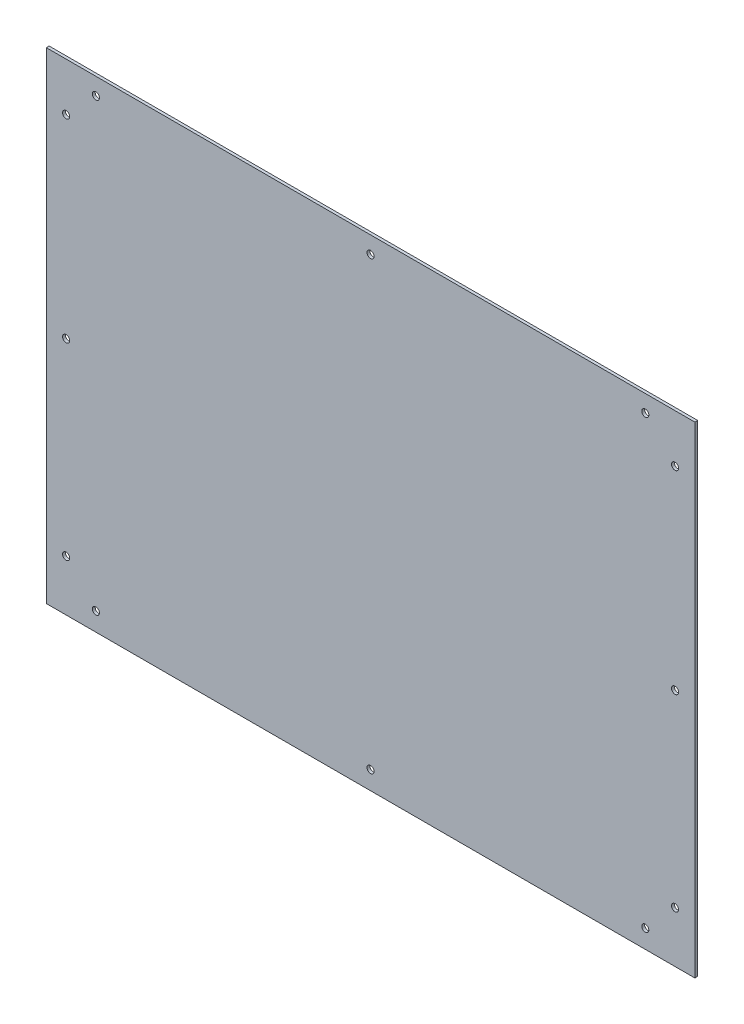
from build123d import *

# Parameters (mm, degrees)
SKETCH1_W           = 458
SKETCH1_H           = 338
BOSS_EXTRUDE1_DEPTH = 2
SKETCH2_R           = 2.5
CUT_EXTRUDE1_DEPTH  = 285.615530145
SKETCH3_W           = 458
SKETCH3_H           = 2
BOSS_EXTRUDE2_DEPTH = 2


with BuildPart() as part:
    # Sketch1 → Boss-Extrude1 (new body)
    with BuildSketch(Plane.XY):
        Rectangle(SKETCH1_W, SKETCH1_H)
    extrude(amount=BOSS_EXTRUDE1_DEPTH)

    # Sketch2 → Cut-Extrude1 (cut, through all)
    with BuildSketch(Plane.XY.offset(2)):
        with Locations((-194, 159)):
            Circle(SKETCH2_R)
        with Locations((-194.002577337, -156)):
            Circle(SKETCH2_R)
        with Locations((193.997422663, -156)):
            Circle(SKETCH2_R)
        with Locations((194, 159)):
            Circle(SKETCH2_R)
        with Locations((-215, 0)):
            Circle(SKETCH2_R)
        with Locations((-215, -133)):
            Circle(SKETCH2_R)
        with Locations((-215, 137)):
            Circle(SKETCH2_R)
        with Locations((215, 0)):
            Circle(SKETCH2_R)
        with Locations((215, -133)):
            Circle(SKETCH2_R)
        with Locations((215, 137)):
            Circle(SKETCH2_R)
        with Locations((0, 159)):
            Circle(SKETCH2_R)
        with Locations((-0.002577337, -156)):
            Circle(SKETCH2_R)
    extrude(amount=-CUT_EXTRUDE1_DEPTH, mode=Mode.SUBTRACT)

    # Sketch3 → Boss-Extrude2 (add, through all)
    with BuildSketch(Plane.XY.offset(2)):
        with Locations((0, 170)):
            Rectangle(SKETCH3_W, SKETCH3_H)
    extrude(amount=-BOSS_EXTRUDE2_DEPTH)


solid = part.part
